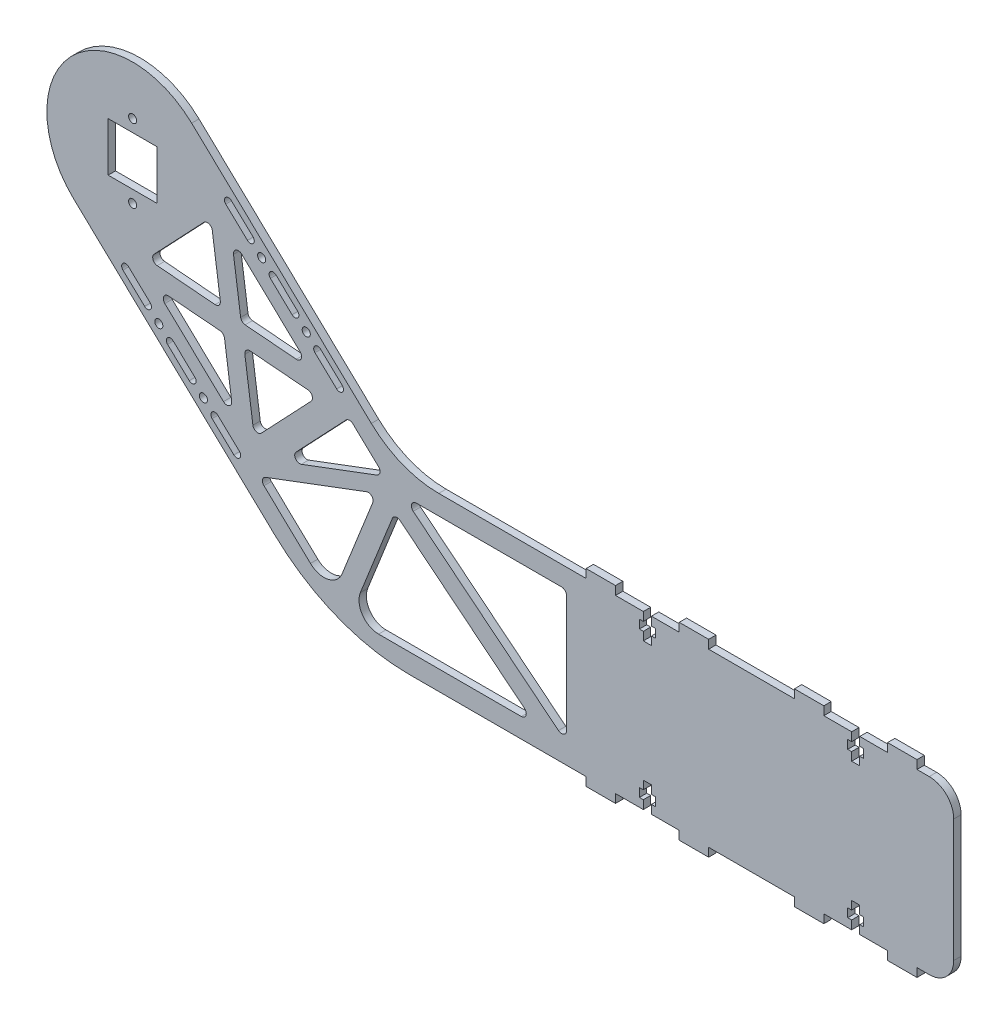
from build123d import *

# Parameters (mm, degrees)
SKETCH_1_R          = 7.65
EXTRUDE_1_DEPTH     = 3
FILLET_1_R          = 10
SKETCH_3_R          = 1.65
CUT_EXTRUDE_2_DEPTH = 358.573768613
FILLET_2_R          = 40
FILLET_3_R          = 80
SKETCH_4_W          = 12
SKETCH_4_H          = 3.5
EXTRUDE_2_DEPTH     = 3
CUT_EXTRUDE_3_DEPTH = 359.812276825
FILLET_4_R          = 2
FILLET_5_R          = 8
SKETCH_7_R          = 1.65
SKETCH_7_W          = 20
SKETCH_7_H          = 20
CUT_EXTRUDE_4_DEPTH = 359.812276825


with BuildPart() as part:
    # 草图1 → 凸台-拉伸1 (new body)
    with BuildSketch(Plane.XY):
        with BuildLine():
            Line((108.946536832, -55), (24.071062677, 25.408343937))
            ThreePointArc((24.071062677, 25.408343937), (-25.408343937, 24.071062677), (-24.071062677, -25.408343937))
            Line((-24.071062677, -25.408343937), (81.053463168, -125))
            Line((81.053463168, -125), (335, -125))
            Line((335, -125), (335, -55))
            Line((335, -55), (108.946536832, -55))
        make_face()
        Circle(SKETCH_1_R, mode=Mode.SUBTRACT)
    extrude(amount=EXTRUDE_1_DEPTH)

    # 圆角1
    fillet_1_edges = [part.edges().sort_by_distance(p)[0] for p in [
        (335, -125, 1.5),
        (335, -55, 1.5),
    ]]
    fillet(fillet_1_edges, radius=FILLET_1_R)

    # 草图3 → 切除-拉伸2 (cut, through all)
    with BuildSketch(Plane.XY.offset(3)):
        with Locations((10.675325257, -52.127223508)):
            Circle(SKETCH_3_R)
        with Locations((52.62774878, -7.84410979)):
            Circle(SKETCH_3_R)
        with Locations((70.824604166, -24.986876604)):
            Circle(SKETCH_3_R)
        with Locations((28.872180643, -69.269990322)):
            Circle(SKETCH_3_R)
        Polygon((293.35, -55), (293.35, -58.5), (291.75, -58.5), (291.75, -62), (293.35, -62), (293.35, -65.4), (296.65, -65.4), (296.65, -62), (298.25, -62), (298.25, -58.5), (296.65, -58.5), (296.65, -55), align=None)
        with BuildLine():
            Line((40.259807528, 6.14576259), (49.116430272, -2.244722115))
            ThreePointArc((49.116430272, -2.244722115), (49.179473531, -4.577322712), (46.846872934, -4.640365972))
            Line((46.846872934, -4.640365972), (37.99025019, 3.750118733))
            ThreePointArc((37.99025019, 3.750118733), (37.92720693, 6.08271933), (40.259807528, 6.14576259))
        make_face()
        with BuildLine():
            Line((16.504239392, -55.280117943), (25.360862135, -63.670602647))
            ThreePointArc((25.360862135, -63.670602647), (25.423905395, -66.003203245), (23.091304797, -66.066246504))
            Line((23.091304797, -66.066246504), (14.234682054, -57.6757618))
            ThreePointArc((14.234682054, -57.6757618), (14.171638794, -55.343161202), (16.504239392, -55.280117943))
        make_face()
        Polygon((208.35, -55), (208.35, -58.5), (206.75, -58.5), (206.75, -62), (208.35, -62), (208.35, -65.4), (211.65, -65.4), (211.65, -62), (213.25, -62), (213.25, -58.5), (211.65, -58.5), (211.65, -55), align=None)
        with BuildLine():
            Line((-1.692615995, -38.137351128), (7.164006749, -46.527835833))
            ThreePointArc((7.164006749, -46.527835833), (7.227050008, -48.86043643), (4.894449411, -48.92347969))
            Line((4.894449411, -48.92347969), (-3.962173333, -40.532994985))
            ThreePointArc((-3.962173333, -40.532994985), (-4.025216592, -38.200394388), (-1.692615995, -38.137351128))
        make_face()
        with BuildLine():
            Line((58.456662914, -10.997004225), (67.313285658, -19.387488929))
            ThreePointArc((67.313285658, -19.387488929), (67.376328917, -21.720089527), (65.04372832, -21.783132786))
            Line((65.04372832, -21.783132786), (56.187105576, -13.392648081))
            ThreePointArc((56.187105576, -13.392648081), (56.124062317, -11.060047484), (58.456662914, -10.997004225))
        make_face()
        with BuildLine():
            Line((34.701094778, -72.422884757), (43.557717522, -80.813369462))
            ThreePointArc((43.557717522, -80.813369462), (43.620760781, -83.145970059), (41.288160183, -83.209013319))
            Line((41.288160183, -83.209013319), (32.43153744, -74.818528614))
            ThreePointArc((32.43153744, -74.818528614), (32.36849418, -72.485928017), (34.701094778, -72.422884757))
        make_face()
        with BuildLine():
            Line((76.6535183, -28.139771039), (85.510141044, -36.530255744))
            ThreePointArc((85.510141044, -36.530255744), (85.573184303, -38.862856341), (83.240583706, -38.9258996))
            Line((83.240583706, -38.9258996), (74.383960962, -30.535414896))
            ThreePointArc((74.383960962, -30.535414896), (74.320917703, -28.202814298), (76.6535183, -28.139771039))
        make_face()
        Polygon((208.35, -125), (211.65, -125), (211.65, -121.5), (213.25, -121.5), (213.25, -118), (211.65, -118), (211.65, -114.6), (208.35, -114.6), (208.35, -118), (206.75, -118), (206.75, -121.5), (208.35, -121.5), align=None)
        Polygon((293.35, -125), (296.65, -125), (296.65, -121.5), (298.25, -121.5), (298.25, -118), (296.65, -118), (296.65, -114.6), (293.35, -114.6), (293.35, -118), (291.75, -118), (291.75, -121.5), (293.35, -121.5), align=None)
    extrude(amount=-CUT_EXTRUDE_2_DEPTH, mode=Mode.SUBTRACT)

    # 圆角2
    fillet_2_edges = [part.edges().sort_by_distance(p)[0] for p in [
        (108.946536832, -55, 1.5),
    ]]
    fillet(fillet_2_edges, radius=FILLET_2_R)

    # 圆角3
    fillet_3_edges = [part.edges().sort_by_distance(p)[0] for p in [
        (81.053463168, -125, 1.5),
    ]]
    fillet(fillet_3_edges, radius=FILLET_3_R)

    # 草图4 → 凸台-拉伸2 (add)
    with BuildSketch(Plane.XY.offset(3)):
        with Locations((229, -53.25)):
            Rectangle(SKETCH_4_W, SKETCH_4_H)
        with Locations((191, -53.25)):
            Rectangle(SKETCH_4_W, SKETCH_4_H)
        with Locations((191, -126.75)):
            Rectangle(SKETCH_4_W, SKETCH_4_H)
        with Locations((229, -126.75)):
            Rectangle(SKETCH_4_W, SKETCH_4_H)
        with Locations((276, -53.25)):
            Rectangle(SKETCH_4_W, SKETCH_4_H)
        with Locations((314, -53.25)):
            Rectangle(SKETCH_4_W, SKETCH_4_H)
        with Locations((314, -126.75)):
            Rectangle(SKETCH_4_W, SKETCH_4_H)
        with Locations((276, -126.75)):
            Rectangle(SKETCH_4_W, SKETCH_4_H)
    extrude(amount=-EXTRUDE_2_DEPTH)

    # 草图5 → 切除-拉伸3 (cut, through all)
    with BuildSketch(Plane.XY.offset(3)):
        Polygon((177, -63), (110.064623342, -63), (177, -117), align=None)
        Polygon((164.258962408, -117), (106.965171731, -70.778332908), (88.547109373, -117), align=None)
        Polygon((51.267400605, -85.76162298), (81.115387776, -114.038663458), (99.628540229, -67.578359825), align=None)
        Polygon((88.405611592, -46.560178049), (60.700016606, -75.804972756), (102.632901746, -60.038663458), align=None)
        Polygon((31.908222762, -4.123827144), (5.863964762, -31.614988366), (36.117464403, -34.130622562), align=None)
        Polygon((37.256837481, -42.252972804), (8.997139252, -39.903126867), (41.207790102, -70.418480303), align=None)
        Polygon((72.439329394, -37.15085251), (40.355766152, -6.75589786), (44.29113023, -34.810277925), align=None)
        Polygon((75.684002949, -45.448262363), (45.430503308, -42.932628167), (49.639744949, -72.939423585), align=None)
    extrude(amount=-CUT_EXTRUDE_3_DEPTH, mode=Mode.SUBTRACT)

    # 圆角4
    fillet_4_edges = [part.edges().sort_by_distance(p)[0] for p in [
        (110.064623342, -63, 1.5),
        (177, -63, 1.5),
        (177, -117, 1.5),
        (164.258962408, -117, 1.5),
        (106.965171731, -70.778332908, 1.5),
        (99.628540229, -67.578359825, 1.5),
        (51.267400605, -85.76162298, 1.5),
        (60.700016606, -75.804972756, 1.5),
        (102.632901746, -60.038663458, 1.5),
        (88.405611592, -46.560178049, 1.5),
        (8.997139252, -39.903126867, 1.5),
        (37.256837481, -42.252972804, 1.5),
        (41.207790102, -70.418480303, 1.5),
        (49.639744949, -72.939423585, 1.5),
        (75.684002949, -45.448262363, 1.5),
        (45.430503308, -42.932628167, 1.5),
        (44.29113023, -34.810277925, 1.5),
        (72.439329394, -37.15085251, 1.5),
        (40.355766152, -6.75589786, 1.5),
        (36.117464403, -34.130622562, 1.5),
        (5.863964762, -31.614988366, 1.5),
        (31.908222762, -4.123827144, 1.5),
    ]]
    fillet(fillet_4_edges, radius=FILLET_4_R)

    # 圆角5
    fillet_5_edges = [part.edges().sort_by_distance(p)[0] for p in [
        (81.115387776, -114.038663458, 1.5),
        (88.547109373, -117, 1.5),
    ]]
    fillet(fillet_5_edges, radius=FILLET_5_R)

    # 草图7 → 切除-拉伸4 (cut, through all)
    with BuildSketch(Plane.XY.offset(3)):
        with Locations((0, 15)):
            Circle(SKETCH_7_R)
        with Locations((0, -15)):
            Circle(SKETCH_7_R)
        Rectangle(SKETCH_7_W, SKETCH_7_H)
    extrude(amount=-CUT_EXTRUDE_4_DEPTH, mode=Mode.SUBTRACT)


solid = part.part
